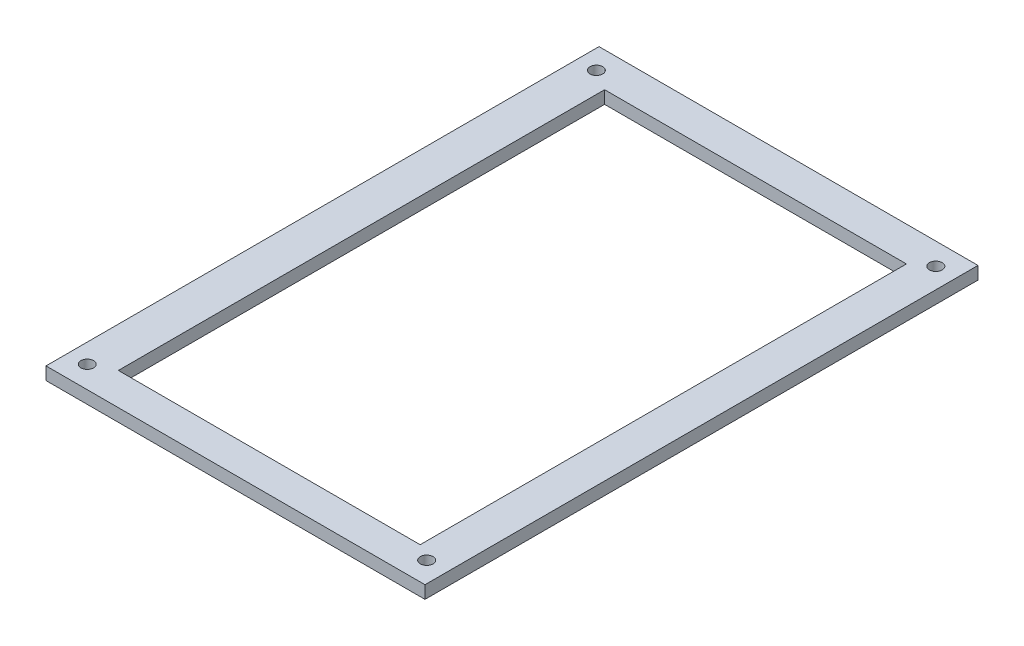
from build123d import *

# Parameters (mm, degrees)
SKETCH1_W           = 97
SKETCH1_H           = 200
BOSS_EXTRUDE1_DEPTH = 42
SKETCH3_R           = 1.5
CUT_EXTRUDE1_DEPTH  = 3
SKETCH4_W           = 97
SKETCH4_H           = 200
SKETCH4_W_2         = 89.324278463
SKETCH4_H_2         = 130.340528777
CUT_EXTRUDE2_DEPTH  = 227.214499977
SKETCH5_W           = 71.136204213
SKETCH5_H           = 114.608329011
CUT_EXTRUDE3_DEPTH  = 213.410706636
SKETCH6_W           = 89.324278463
SKETCH6_H           = 39
CUT_EXTRUDE4_DEPTH  = 166.700724789


with BuildPart() as part:
    # Sketch1 → Boss-Extrude1 (new body)
    with BuildSketch(Plane(origin=(0, 0, 0), x_dir=(1, 0, 0), z_dir=(0, 1, 0))):
        with Locations((48.5, 100)):
            Rectangle(SKETCH1_W, SKETCH1_H)
    extrude(amount=BOSS_EXTRUDE1_DEPTH)

    # Sketch3 → Cut-Extrude1 (cut)
    with BuildSketch(Plane(origin=(0, 42, 0), x_dir=(1, 0, 0), z_dir=(0, 1, 0))):
        with Locations(Location((88.5, 61, 0), (0, 0, 270))):
            Circle(SKETCH3_R)
        with Locations(Location((8.5, 61, 0), (0, 0, 270))):
            Circle(SKETCH3_R)
        with Locations(Location((88.5, 181, 0), (0, 0, 270))):
            Circle(SKETCH3_R)
        with Locations(Location((8.5, 181, 0), (0, 0, 270))):
            Circle(SKETCH3_R)
    extrude(amount=-CUT_EXTRUDE1_DEPTH, mode=Mode.SUBTRACT)

    # Sketch4 → Cut-Extrude2 (cut, through all)
    with BuildSketch(Plane(origin=(0, 42, 0), x_dir=(1, 0, 0), z_dir=(0, 1, 0))):
        with Locations((48.5, 100)):
            Rectangle(SKETCH4_W, SKETCH4_H)
        with Locations((48.633502434, 120.975462234)):
            Rectangle(SKETCH4_W_2, SKETCH4_H_2, mode=Mode.SUBTRACT)
    extrude(amount=-CUT_EXTRUDE2_DEPTH, mode=Mode.SUBTRACT)

    # Sketch5 → Cut-Extrude3 (cut, through all)
    with BuildSketch(Plane(origin=(0, 42, 0), x_dir=(1, 0, 0), z_dir=(0, 1, 0))):
        with Locations((48.992776193, 120.706006915)):
            Rectangle(SKETCH5_W, SKETCH5_H)
    extrude(amount=-CUT_EXTRUDE3_DEPTH, mode=Mode.SUBTRACT)

    # Sketch6 → Cut-Extrude4 (cut, through all)
    with BuildSketch(Plane(origin=(0, 0, -186.145726622), x_dir=(-1, 0, 0), z_dir=(0, 0, -1))):
        with Locations((-48.633502434, 19.5)):
            Rectangle(SKETCH6_W, SKETCH6_H)
    extrude(amount=-CUT_EXTRUDE4_DEPTH, mode=Mode.SUBTRACT)


solid = part.part
